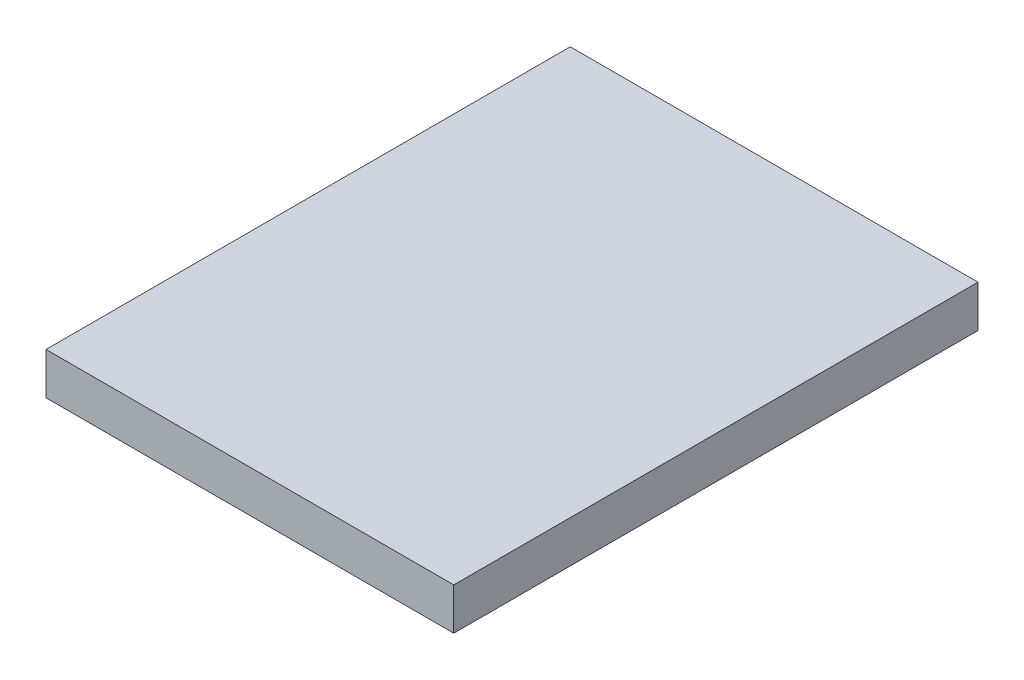
from build123d import *

# Parameters (mm, degrees)
SKETCH3_W           = 177.8
SKETCH3_H           = 228.6
BOSS_EXTRUDE1_DEPTH = 18.25625


with BuildPart() as part:
    # Sketch3 → Boss-Extrude1 (new body)
    with BuildSketch(Plane(origin=(0, 0, 0), x_dir=(1, 0, 0), z_dir=(0, 1, 0))):
        with Locations((0, 114.3)):
            Rectangle(SKETCH3_W, SKETCH3_H)
    extrude(amount=BOSS_EXTRUDE1_DEPTH)


solid = part.part
